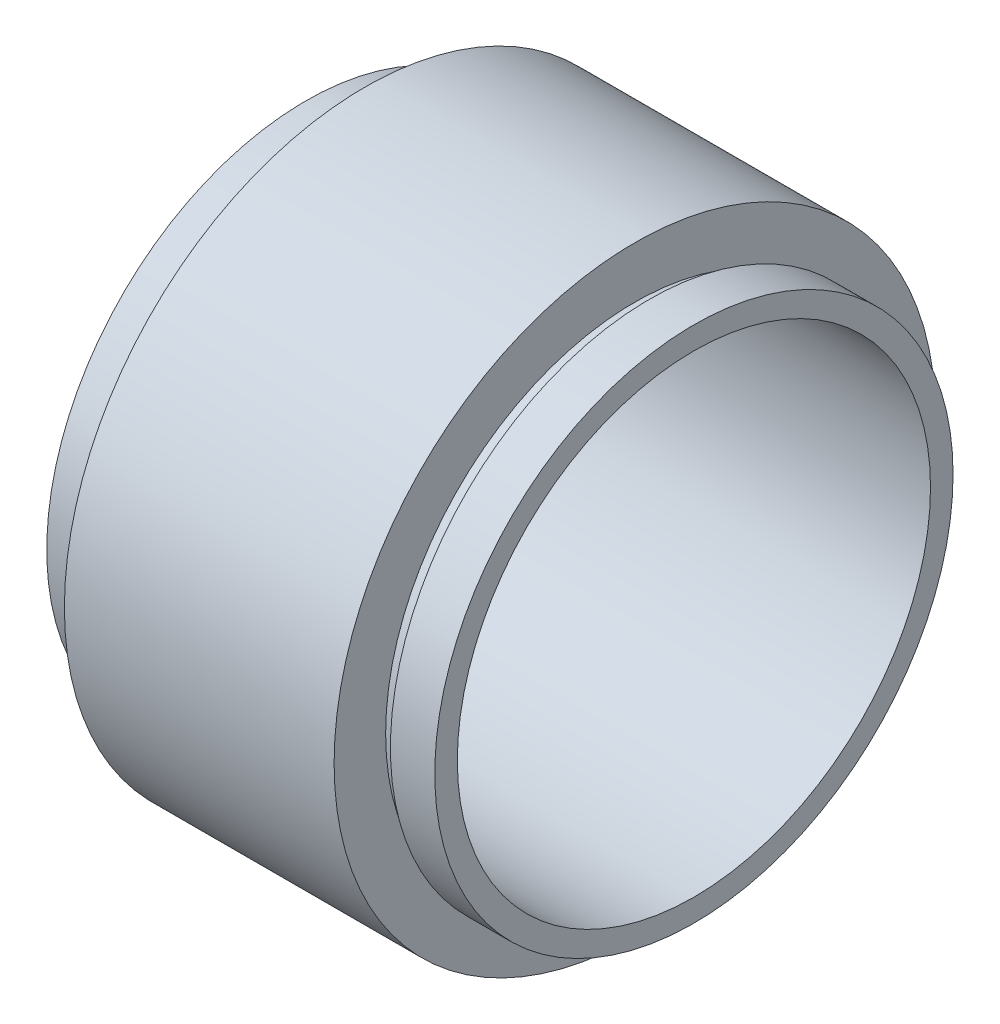
from build123d import *

# Parameters (mm, degrees)
SKETCH3_R          = 12
CUT_EXTRUDE1_DEPTH = 30.196359362


with BuildPart() as part:
    # Sketch2 → Revolve1 (revolve)
    with BuildSketch(Plane.XY, mode=Mode.PRIVATE) as revolve1_sk:
        Polygon((9.84, 0), (-9.84, 0), (-9.84, 13.1445), (-7.59, 13.1445), (-7.59, 12.6365), (-6.84, 12.6365), (-6.84, 15.25), (6.84, 15.25), (6.84, 12.6365), (7.59, 12.6365), (7.59, 13.1445), (9.84, 13.1445), align=None)
    revolve(revolve1_sk.sketch.rotate(Axis((9.84, 0, 0), (-1, 0, 0)), 90), axis=Axis((9.84, 0, 0), (-1, 0, 0)))

    # Sketch3 → Cut-Extrude1 (cut, through all)
    with BuildSketch(Plane.ZY.offset(9.84)):
        with Locations(Location((0, 0, 0), (0, 0, 270))):
            Circle(SKETCH3_R)
    extrude(amount=-CUT_EXTRUDE1_DEPTH, mode=Mode.SUBTRACT)


solid = part.part
